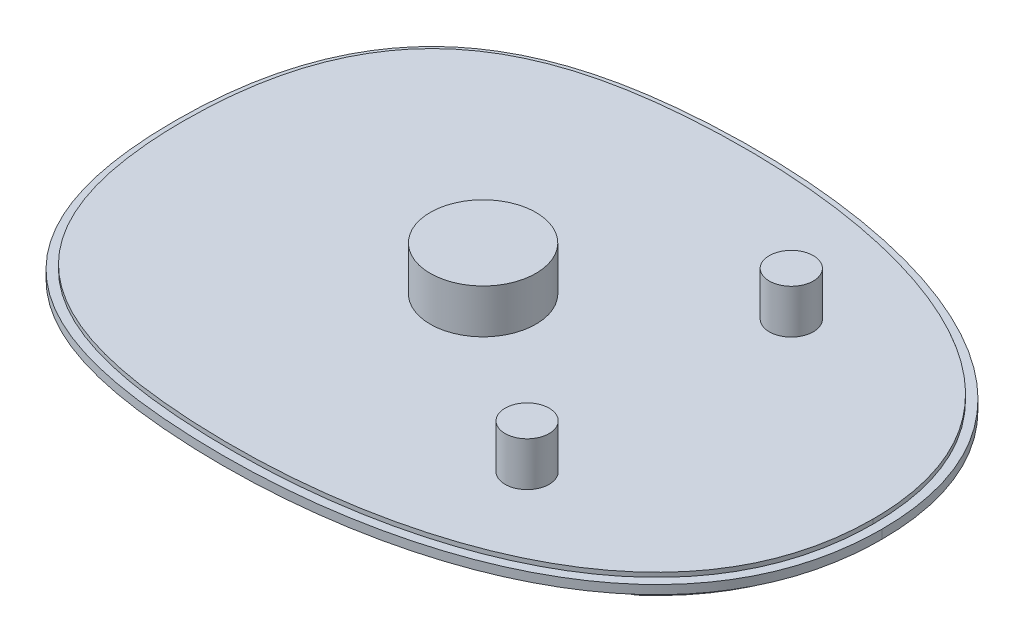
from build123d import *

# Parameters (mm, degrees)
BOSS_EXTRUDE1_DEPTH   = 1.5
BOSS_EXTRUDE1_2_DEPTH = 1.5
BOSS_EXTRUDE1_3_DEPTH = 1.5
FILLET1_R             = 3
FILLET2_R             = 3
FILLET3_R             = 3
FILLET4_R             = 3
FILLET5_R             = 1
FILLET6_R             = 1
THICKEN1_T1           = 1
BOSS_EXTRUDE2_DEPTH   = 0.5
SKETCH17_R            = 6
SKETCH17_R_2          = 2.5
BOSS_EXTRUDE3_DEPTH   = 5
CUT_EXTRUDE1_DEPTH    = 0.2


with BuildPart() as part:
    # Sketch15 → Boss-Extrude1 (new body)
    with BuildSketch(Plane(origin=(0, 0, 0), x_dir=(1, 0, 0), z_dir=(0, 1, 0))):
        with BuildLine():
            Line((19.985257037, -7.839704856), (28.712135723, -7.839704856))
            ThreePointArc((28.712135723, -7.839704856), (30.917651866, -16.701566284), (34.673373633, -25.025714494))
            add(Edge.make_bspline(
                [(19.985257037, -7.839704856), (20.003327882, -7.930211158), (20.19506768, -8.87054248), (20.822765862, -11.376552189), (22.196120959, -14.845666289), (24.350543071, -18.216816198), (26.968787622, -20.920168116), (30.034380428, -23.060139462), (32.704245401, -24.316847198), (34.310045449, -24.901265657), (34.673373633, -25.025714494)],
                knots=[0.059197915, 0.059197915, 0.059197915, 0.059197915, 0.061364536, 0.081819381, 0.122729072, 0.163638762, 0.204548453, 0.245458143, 0.286367834, 0.298081639, 0.298081639, 0.298081639, 0.298081639], degree=3))
        make_face()
    extrude(amount=-BOSS_EXTRUDE1_DEPTH)

    # Fillet1
    fillet1_edges = [part.edges().sort_by_distance(p)[0] for p in [
        (34.673373633, -0.75, 25.025714494),
    ]]
    fillet(fillet1_edges, radius=FILLET1_R)

    # Fillet5
    fillet5_edges = [part.edges().sort_by_distance(p)[0] for p in [
        (28.712135723, -0.75, 7.839704856),
        (19.985257037, -0.75, 7.839704856),
    ]]
    fillet(fillet5_edges, radius=FILLET5_R)



with BuildPart() as body_2:
    # Sketch15 → Boss-Extrude1 2 (new body)
    with BuildSketch(Plane(origin=(0, 0, 0), x_dir=(1, 0, 0), z_dir=(0, 1, 0))):
        with BuildLine():
            Line((19.829867125, 7.839704856), (28.726233836, 7.839704856))
            ThreePointArc((28.726233836, 7.839704856), (31.127428694, 17.204163616), (35.258274132, 25.944583548))
            add(Edge.make_bspline(
                [(35.258274132, 25.944583548), (34.667512014, 25.754792743), (32.849163506, 25.111219527), (30.008079189, 23.768252633), (26.974920854, 21.65550934), (24.380595333, 18.997450924), (22.240896245, 15.694723246), (20.869798385, 12.305832928), (20.156117717, 9.547170615), (19.906876439, 8.276418024), (19.829867125, 7.839704856)],
                knots=[0.694472016, 0.694472016, 0.694472016, 0.694472016, 0.713148327, 0.753574179, 0.79400003, 0.834425881, 0.874851733, 0.915277584, 0.93549051, 0.945706924, 0.945706924, 0.945706924, 0.945706924], degree=3))
        make_face()
    extrude(amount=-BOSS_EXTRUDE1_2_DEPTH)

    # Fillet4
    fillet4_edges = [body_2.edges().sort_by_distance(p)[0] for p in [
        (35.258274132, -0.75, -25.944583548),
    ]]
    fillet(fillet4_edges, radius=FILLET4_R)

    # Fillet6
    fillet6_edges = [body_2.edges().sort_by_distance(p)[0] for p in [
        (28.726233836, -0.75, -7.839704856),
        (19.829867125, -0.75, -7.839704856),
    ]]
    fillet(fillet6_edges, radius=FILLET6_R)


with BuildPart() as body_3:
    # Sketch15 → Boss-Extrude1 3 (new body)
    with BuildSketch(Plane(origin=(0, 0, 0), x_dir=(1, 0, 0), z_dir=(0, 1, 0))):
        with BuildLine():
            ThreePointArc((77.380385855, -23.979122304), (85.811237438, 0), (77.380385855, 23.979122304))
            add(Edge.make_bspline(
                [(95.498366587, 0), (95.498366587, 0.421420358), (95.480029873, 1.273198105), (95.372179086, 2.902910453), (95.107917012, 4.854394326), (94.595758418, 7.05015953), (93.667041221, 9.799066074), (92.068914092, 12.917495162), (89.510281921, 16.206100443), (86.361572684, 19.072659912), (82.684034418, 21.530514445), (79.576000935, 23.075648772), (77.752531845, 23.830842642), (77.380385855, 23.979122304)],
                knots=[0, 0, 0, 0, 0.010892264, 0.021784527, 0.043569055, 0.065353582, 0.087138109, 0.130707164, 0.174276219, 0.217845274, 0.261414328, 0.304983383, 0.31599972, 0.31599972, 0.31599972, 0.31599972], degree=3))
            add(Edge.make_bspline(
                [(77.380385855, -23.979122304), (77.752531845, -23.830842642), (79.576000935, -23.075648772), (82.684034418, -21.530514445), (86.361572684, -19.072659912), (89.510281921, -16.206100443), (92.068914092, -12.917495162), (93.667041221, -9.799066074), (94.595758418, -7.05015953), (95.107917012, -4.854394326), (95.372179086, -2.902910453), (95.480029873, -1.273198105), (95.498366587, -0.421420358), (95.498366587, 0)],
                knots=[0.68400028, 0.68400028, 0.68400028, 0.68400028, 0.695016617, 0.738585672, 0.782154726, 0.825723781, 0.869292836, 0.912861891, 0.934646418, 0.956430945, 0.978215473, 0.989107736, 1, 1, 1, 1], degree=3))
        make_face()
    extrude(amount=-BOSS_EXTRUDE1_3_DEPTH)

    # Fillet2
    fillet2_edges = [body_3.edges().sort_by_distance(p)[0] for p in [
        (77.380385855, -0.75, 23.979122304),
    ]]
    fillet(fillet2_edges, radius=FILLET2_R)

    # Fillet3
    fillet3_edges = [body_3.edges().sort_by_distance(p)[0] for p in [
        (77.380385855, -0.75, -23.979122304),
    ]]
    fillet(fillet3_edges, radius=FILLET3_R)


with BuildPart() as part_1:
    add(part.part)

    add(body_2.part)  # Thicken1 merges body 2

    add(body_3.part)  # Thicken1 merges body 3
    # Sketch6 → Surface-Fill3: a flat surface bounded by the sketch
    with BuildSketch(Plane(origin=(0, 0, 0), x_dir=(1, 0, 0), z_dir=(0, 1, 0)), mode=Mode.PRIVATE) as surface_fill3_1_region:
        with BuildLine():
            add(Edge.make_bspline(
                [(17.2, 0), (17.2, -23.333333333), (49.687338171, -36.667533587), (97.498366587, -24.295652903), (97.498366587, 0)],
                knots=[0, 0, 0, 0, 0.420096817, 1, 1, 1, 1], degree=3))
            add(Edge.make_bspline(
                [(17.2, 0), (17.2, 23.333333333), (49.687338171, 36.667533587), (97.498366587, 24.295652903), (97.498366587, 0)],
                knots=[0, 0, 0, 0, 0.420096817, 1, 1, 1, 1], degree=3))
        make_face()
    surface_fill3_1 = surface_fill3_1_region.sketch.faces()[0]
    add(Solid.thicken(surface_fill3_1, THICKEN1_T1))

    # Sketch16 → Boss-Extrude2 (add)
    with BuildSketch(Plane(origin=(0, 1, 0), x_dir=(1, 0, 0), z_dir=(0, 1, 0))):
        with BuildLine():
            add(Edge.make_bspline(
                [(18.2, 0), (18.2, -2.319951803), (18.334480918, -4.617329005), (18.827932577, -8.014423587), (19.041503894, -9.1385484), (19.590928847, -11.366271139), (19.926597118, -12.469900182), (20.547870155, -14.105574212), (20.775182689, -14.647972419), (21.265078447, -15.70546511), (21.528500631, -16.222968933), (22.377548466, -17.739709111), (23.02191076, -18.703201334), (24.120383261, -20.068154363), (24.510010841, -20.510932445), (25.318703906, -21.351822368), (25.73927951, -21.752080378), (27.047724476, -22.894742824), (27.982330349, -23.579012838), (29.469396963, -24.49949212), (29.981234063, -24.789580186), (31.016634496, -25.32876011), (31.541282711, -25.57873407), (33.133663267, -26.276606578), (34.219744543, -26.672701318), (36.430656907, -27.35549002), (37.555521968, -27.642088063), (39.836245226, -28.127782478), (40.983419803, -28.324956004), (43.276328762, -28.648122937), (44.424288274, -28.774491875), (46.722493271, -28.97374292), (47.872710153, -29.047294286), (51.326241924, -29.200536204), (53.632537121, -29.210493992), (57.098083649, -29.082616463), (58.25428999, -29.016027363), (60.568869844, -28.832142015), (61.72555, -28.714870915), (65.171687852, -28.285075939), (67.445525535, -27.894847676), (71.937678408, -26.870296833), (74.156167645, -26.236739422), (77.429977205, -25.049335171), (78.515414888, -24.611948082), (80.634220391, -23.656756483), (81.670406519, -23.13822515), (83.689595073, -22.007389018), (84.672634064, -21.39514869), (86.576140588, -20.060342087), (87.500431292, -19.333562472), (89.23238766, -17.785919257), (90.044685336, -16.962528658), (91.173879886, -15.645026809), (91.535379562, -15.19210213), (92.226814263, -14.257105733), (92.557779862, -13.773369907), (94.116731862, -11.296439965), (95.029709876, -9.177974705), (95.778623314, -6.369156714), (95.909084266, -5.79744551), (96.129370705, -4.648270593), (96.219216886, -4.071639324), (96.432017008, -2.336032244), (96.498366587, -1.171356657), (96.498366587, 0)],
                knots=[0, 0, 0, 0, 0.0625, 0.0625, 0.09375, 0.09375, 0.125, 0.125, 0.140625, 0.140625, 0.15625, 0.15625, 0.1875, 0.1875, 0.203125, 0.203125, 0.21875, 0.21875, 0.25, 0.25, 0.265625, 0.265625, 0.28125, 0.28125, 0.3125, 0.3125, 0.34375, 0.34375, 0.375, 0.375, 0.40625, 0.40625, 0.4375, 0.4375, 0.5, 0.5, 0.53125, 0.53125, 0.5625, 0.5625, 0.625, 0.625, 0.6875, 0.6875, 0.71875, 0.71875, 0.75, 0.75, 0.78125, 0.78125, 0.8125, 0.8125, 0.84375, 0.84375, 0.859375, 0.859375, 0.875, 0.875, 0.9375, 0.9375, 0.953125, 0.953125, 0.96875, 0.96875, 1, 1, 1, 1], degree=3))
            add(Edge.make_bspline(
                [(96.498366587, 0), (96.498366587, 2.341465081), (96.234921911, 4.641317325), (95.49130255, 7.450689054), (95.321457859, 8.009986807), (94.93823358, 9.118541645), (94.72702697, 9.661656603), (94.035471632, 11.257997126), (93.497217593, 12.27823554), (92.270096422, 14.232912004), (91.58021104, 15.16854787), (90.056800359, 16.950715362), (89.239616549, 17.778851526), (87.509291531, 19.326247637), (86.596106607, 20.045457981), (85.162618156, 21.05198496), (84.673657295, 21.375618952), (83.686089057, 21.993803244), (83.1862245, 22.289282382), (80.659183592, 23.70462218), (78.550093097, 24.641091804), (75.288700663, 25.826936587), (74.18503237, 26.185193734), (71.947985079, 26.8351911), (70.82243225, 27.124595967), (67.439462869, 27.896352959), (65.170195987, 28.284788257), (60.608746924, 28.854626812), (58.316524547, 29.035666912), (54.862565468, 29.166055797), (53.708623408, 29.185826545), (51.395555209, 29.178531642), (50.234853989, 29.151392712), (47.915911607, 29.049895995), (46.759219814, 28.976411782), (44.452196856, 28.777412542), (43.301952366, 28.651188501), (41.00996081, 28.32923033), (39.868203548, 28.133579605), (37.59576977, 27.651636123), (36.464837628, 27.364781325), (34.253315266, 26.684295288), (33.168748543, 26.290012833), (31.581608945, 25.597339452), (31.059201456, 25.349520779), (30.029287266, 24.815890941), (29.520321487, 24.529172924), (28.028584851, 23.611064336), (27.093051719, 22.929598956), (25.785539063, 21.794660396), (25.365657609, 21.397567358), (24.558915349, 20.564516278), (24.170785737, 20.126966018), (23.066185963, 18.765146125), (22.419117315, 17.80498783), (21.566843492, 16.295501858), (21.302489472, 15.780789239), (20.810860536, 14.729664586), (20.583038128, 14.191797073), (19.955634298, 12.557675243), (19.615286885, 11.451908376), (19.057256961, 9.214632746), (18.8397312, 8.083091088), (18.50440609, 5.799079644), (18.386655934, 4.645950795), (18.234286234, 2.324940498), (18.2, 1.163040827), (18.2, 0)],
                knots=[0, 0, 0, 0, 0.0625, 0.0625, 0.078125, 0.078125, 0.09375, 0.09375, 0.125, 0.125, 0.15625, 0.15625, 0.1875, 0.1875, 0.21875, 0.21875, 0.234375, 0.234375, 0.25, 0.25, 0.3125, 0.3125, 0.34375, 0.34375, 0.375, 0.375, 0.4375, 0.4375, 0.5, 0.5, 0.53125, 0.53125, 0.5625, 0.5625, 0.59375, 0.59375, 0.625, 0.625, 0.65625, 0.65625, 0.6875, 0.6875, 0.71875, 0.71875, 0.734375, 0.734375, 0.75, 0.75, 0.78125, 0.78125, 0.796875, 0.796875, 0.8125, 0.8125, 0.84375, 0.84375, 0.859375, 0.859375, 0.875, 0.875, 0.90625, 0.90625, 0.9375, 0.9375, 0.96875, 0.96875, 1, 1, 1, 1], degree=3))
        make_face()
    extrude(amount=BOSS_EXTRUDE2_DEPTH)

    # Sketch17 → Boss-Extrude3 (add)
    with BuildSketch(Plane(origin=(0, 1.5, 0), x_dir=(1, 0, 0), z_dir=(0, 1, 0))):
        with Locations(Location((52.2, 0, 0), (0, 0, 270))):
            Circle(SKETCH17_R)
        with Locations(Location((72.2, 15, 0), (0, 0, 90))):
            Circle(SKETCH17_R_2)
        with Locations(Location((72.2, -15, 0), (0, 0, 90))):
            Circle(SKETCH17_R_2)
    extrude(amount=BOSS_EXTRUDE3_DEPTH)

    # Sketch18 → Cut-Extrude1 (cut)
    # profile 1 of 6: a face of its own
    with BuildSketch(Plane.XZ):
        Polygon((47.804610155, 4.439727193), (47.804610155, 4.798701552), (49.644353744, 4.798701552), (49.644353744, 4.439727193), (48.881533232, 4.439727193), (48.881533232, 1.298701552), (48.567430667, 1.298701552), (48.567430667, 4.439727193), align=None)
    # profile 2 of 6: a face of its own
    with BuildSketch(Plane.XZ):
        with BuildLine():
            Line((50.003328103, 3.85639386), (50.317430667, 3.85639386))
            Line((50.317430667, 3.85639386), (50.317430667, 3.479891456))
            add(Edge.make_bspline(
                [(50.317430667, 3.479891456), (50.340619426, 3.514947284), (50.384967747, 3.581991284), (50.458680676, 3.670660584), (50.534184008, 3.744075631), (50.611839195, 3.80257915), (50.692217295, 3.846392269), (50.773554247, 3.878485304), (50.857129717, 3.897462619), (50.913291641, 3.899996278), (50.941429065, 3.901265655)],
                knots=[0, 0, 0, 0, 1.2804753, 2.448899062, 3.506932113, 4.484331642, 5.4025378, 6.288909075, 7.142734305, 8, 8, 8, 8], degree=3))
            add(Edge.make_bspline(
                [(50.941429065, 3.901265655), (50.963255391, 3.900075128), (51.008164477, 3.897625542), (51.076147066, 3.880414718), (51.146190518, 3.852936695), (51.191332906, 3.827096472), (51.214866565, 3.81362543)],
                knots=[0, 0, 0, 0, 0.901110191, 1.854092781, 2.881294221, 4, 4, 4, 4], degree=3))
            Line((51.214866565, 3.81362543), (51.042390603, 3.541590174))
            add(Edge.make_bspline(
                [(51.042390603, 3.541590174), (51.027281582, 3.54833044), (50.998601768, 3.561124755), (50.956647201, 3.576266765), (50.917965865, 3.585182681), (50.893322306, 3.586533399), (50.881833712, 3.58716309)],
                knots=[0, 0, 0, 0, 1.180555205, 2.24091978, 3.179933427, 4, 4, 4, 4], degree=3))
            add(Edge.make_bspline(
                [(50.881833712, 3.58716309), (50.856627979, 3.585483053), (50.805215589, 3.582056264), (50.729731089, 3.555117456), (50.656483884, 3.511592216), (50.598312222, 3.463321104), (50.553269969, 3.416773307), (50.521129743, 3.376124904), (50.491646996, 3.330546273), (50.463476776, 3.280816589), (50.437810482, 3.226086743), (50.413855812, 3.166903529), (50.392196949, 3.103198401), (50.379846705, 3.05881588), (50.373520411, 3.03608136)],
                knots=[0, 0, 0, 0, 1.125678352, 2.296057538, 3.5422874, 4.923748041, 5.663163013, 6.437101912, 7.23742474, 8.08941207, 8.991984279, 9.93940061, 10.944477711, 12, 12, 12, 12], degree=3))
            add(Edge.make_bspline(
                [(50.373520411, 3.03608136), (50.368788018, 3.015804186), (50.358306126, 2.970891788), (50.348114588, 2.895543263), (50.33804507, 2.806519604), (50.330948452, 2.703573011), (50.32437041, 2.586960567), (50.320660327, 2.456504622), (50.317557187, 2.31207127), (50.31747412, 2.211096917), (50.317430667, 2.158276873)],
                knots=[0, 0, 0, 0, 0.566838948, 1.255505196, 2.06880316, 3.007127437, 4.065329342, 5.249902469, 6.561414163, 8, 8, 8, 8], degree=3))
            Line((50.317430667, 2.158276873), (50.317430667, 1.298701552))
            Line((50.317430667, 1.298701552), (50.003328103, 1.298701552))
            Line((50.003328103, 1.298701552), (50.003328103, 3.85639386))
        make_face()
    # profile 3 of 6: a face of its own
    with BuildSketch(Plane.XZ):
        with BuildLine():
            Line((54.131533232, 3.85639386), (54.131533232, 1.298701552))
            Line((54.131533232, 1.298701552), (53.817430667, 1.298701552))
            Line((53.817430667, 1.298701552), (53.817430667, 1.741109405))
            add(Edge.make_bspline(
                [(53.817430667, 1.741109405), (53.782011877, 1.701069811), (53.712891662, 1.62293204), (53.597450544, 1.520849867), (53.475082366, 1.436471546), (53.346381045, 1.36832163), (53.211462801, 1.317129573), (53.070626714, 1.280743414), (52.923815333, 1.257349579), (52.823562978, 1.255013557), (52.772759193, 1.253829757)],
                knots=[0, 0, 0, 0, 1.074387032, 2.096679803, 3.090159297, 4.057316773, 5.018401886, 5.985159533, 6.978961417, 8, 8, 8, 8], degree=3))
            add(Edge.make_bspline(
                [(52.772759193, 1.253829757), (52.727591239, 1.255056129), (52.638518034, 1.25747459), (52.507488957, 1.276236893), (52.381396708, 1.306367515), (52.260122135, 1.348268405), (52.14444999, 1.403849226), (52.033389893, 1.470390474), (51.927517201, 1.549631304), (51.828445662, 1.640219333), (51.737213662, 1.73861432), (51.657152389, 1.843559867), (51.590399309, 1.954602171), (51.534579228, 2.070335325), (51.491582884, 2.191650244), (51.46160925, 2.318127412), (51.442868803, 2.449617286), (51.440451342, 2.539156809), (51.439225539, 2.584558924)],
                knots=[0, 0, 0, 0, 1.033919861, 2.038935746, 3.024066025, 3.998881131, 4.97069526, 5.957263378, 6.95902576, 7.993208707, 9.027059324, 10.027763471, 11.009749337, 11.988697705, 12.965288445, 13.950418724, 14.960734635, 16, 16, 16, 16], degree=3))
            add(Edge.make_bspline(
                [(51.439225539, 2.584558924), (51.440478511, 2.629022627), (51.442955567, 2.716924971), (51.461408787, 2.846203669), (51.492439796, 2.970721929), (51.535987644, 3.090078873), (51.591829599, 3.204418923), (51.659757686, 3.313822948), (51.73977681, 3.418592345), (51.832029217, 3.516263572), (51.931963987, 3.606484186), (52.038872718, 3.684893232), (52.150096, 3.752610081), (52.26735901, 3.806263557), (52.388926115, 3.849672661), (52.515879561, 3.87970563), (52.647691139, 3.897402951), (52.737181632, 3.899965715), (52.782574898, 3.901265655)],
                knots=[0, 0, 0, 0, 1.020392517, 2.01726096, 2.990465484, 3.961182959, 4.928053699, 5.906110375, 6.912531644, 7.948652711, 8.985773172, 9.998621852, 10.987621588, 11.969261332, 12.953316658, 13.946091881, 14.958173133, 16, 16, 16, 16], degree=3))
            add(Edge.make_bspline(
                [(52.782574898, 3.901265655), (52.834774757, 3.899827903), (52.937136217, 3.89700854), (53.086864226, 3.873545813), (53.228508704, 3.833907346), (53.363163056, 3.779989848), (53.490343743, 3.708341119), (53.608846727, 3.617961158), (53.71991221, 3.509419971), (53.784292502, 3.426049526), (53.817430667, 3.383136648)],
                knots=[0, 0, 0, 0, 1.038897134, 2.037228247, 3.008116434, 3.962042015, 4.918381754, 5.904844433, 6.921570401, 8, 8, 8, 8], degree=3))
            Line((53.817430667, 3.383136648), (53.817430667, 3.85639386))
            Line((53.817430667, 3.85639386), (54.131533232, 3.85639386))
        make_face()
        with BuildLine():
            add(Edge.make_bspline(
                [(52.786781629, 3.58716309), (52.740867291, 3.585529453), (52.650239691, 3.582304912), (52.517195689, 3.557131417), (52.389882275, 3.515246822), (52.268936201, 3.457964921), (52.156267984, 3.385936184), (52.055574313, 3.298814801), (51.966031612, 3.198977787), (51.890723348, 3.086875677), (51.829332851, 2.966697585), (51.786165819, 2.841073147), (51.757696571, 2.71226817), (51.754788051, 2.624905484), (51.753328103, 2.581053315)],
                knots=[0, 0, 0, 0, 1.031046209, 2.035121221, 3.029706178, 4.034933723, 5.034054252, 6.02443088, 7.017295772, 8.038157696, 9.050218397, 10.03989886, 11.016116709, 12, 12, 12, 12], degree=3))
            add(Edge.make_bspline(
                [(51.753328103, 2.581053315), (51.755192997, 2.537463208), (51.758915473, 2.450453852), (51.785666168, 2.321473275), (51.830546041, 2.195819233), (51.891788104, 2.074558239), (51.968474729, 1.961974139), (52.057363381, 1.860234017), (52.159313663, 1.772744428), (52.27224117, 1.699506855), (52.39284914, 1.640344334), (52.519683072, 1.599178694), (52.65035871, 1.572600914), (52.739211044, 1.569496437), (52.783977142, 1.567932321)],
                knots=[0, 0, 0, 0, 0.979072187, 1.954306742, 2.945804271, 3.96968567, 4.997920485, 5.998718438, 6.996577872, 8.005894225, 9.015743152, 10.005417472, 10.995077863, 12, 12, 12, 12], degree=3))
            add(Edge.make_bspline(
                [(52.783977142, 1.567932321), (52.829423645, 1.569592285), (52.919812231, 1.572893789), (53.053250939, 1.598175054), (53.182745902, 1.639943852), (53.30653313, 1.697842979), (53.421849261, 1.769600335), (53.525347139, 1.853607426), (53.612863107, 1.95131061), (53.687055717, 2.058687063), (53.745231134, 2.17639906), (53.787607193, 2.30173325), (53.812661098, 2.434693999), (53.815818828, 2.525557926), (53.817430667, 2.571938732)],
                knots=[0, 0, 0, 0, 1.01762866, 2.023962475, 3.030623092, 4.058876274, 5.077231937, 6.066672613, 7.034107872, 8.005628644, 8.981990164, 9.965428785, 10.961468474, 12, 12, 12, 12], degree=3))
            add(Edge.make_bspline(
                [(53.817430667, 2.571938732), (53.816471011, 2.607276562), (53.814582104, 2.676832595), (53.800151534, 2.778960113), (53.777196608, 2.876693839), (53.744850438, 2.970136528), (53.702359153, 3.058771543), (53.651111387, 3.143235304), (53.590205938, 3.223088515), (53.520623242, 3.297231586), (53.444458039, 3.364858048), (53.363863498, 3.425222289), (53.277884751, 3.474811062), (53.187967714, 3.515852333), (53.09395638, 3.548511483), (52.99508576, 3.570299177), (52.892406773, 3.585259498), (52.822360718, 3.586521879), (52.786781629, 3.58716309)],
                knots=[0, 0, 0, 0, 1.050140795, 2.067009409, 3.05949893, 4.030605086, 5.00011959, 5.97591094, 6.962425594, 7.979863591, 8.993523472, 9.986985069, 10.967611495, 11.937549037, 12.921786183, 13.919465291, 14.943216303, 16, 16, 16, 16], degree=3))
        make_face(mode=Mode.SUBTRACT)
    # profile 4 of 6: a face of its own
    with BuildSketch(Plane.XZ):
        with BuildLine():
            Line((54.849481949, 3.85639386), (55.163584514, 3.85639386))
            Line((55.163584514, 3.85639386), (55.163584514, 3.411882642))
            add(Edge.make_bspline(
                [(55.163584514, 3.411882642), (55.191868463, 3.450770244), (55.246063223, 3.525282617), (55.334928876, 3.623472901), (55.423704988, 3.706801055), (55.48763837, 3.750543927), (55.518352142, 3.771558123)],
                knots=[0, 0, 0, 0, 1.134379233, 2.173579362, 3.122582517, 4, 4, 4, 4], degree=3))
            add(Edge.make_bspline(
                [(55.518352142, 3.771558123), (55.560216804, 3.791563488), (55.643214704, 3.831224701), (55.774633929, 3.87145826), (55.909108598, 3.896183361), (55.999916812, 3.899564735), (56.045595732, 3.901265655)],
                knots=[0, 0, 0, 0, 1.014936303, 2.012140481, 3.000054389, 4, 4, 4, 4], degree=3))
            add(Edge.make_bspline(
                [(56.045595732, 3.901265655), (56.076488728, 3.900220364), (56.137624307, 3.89815179), (56.228208397, 3.884691754), (56.316067009, 3.861425581), (56.400681038, 3.829018257), (56.480401718, 3.78977157), (56.553490915, 3.743721863), (56.619115124, 3.692024787), (56.677241175, 3.632345854), (56.7295102, 3.563009256), (56.777589047, 3.482145007), (56.822014259, 3.387937346), (56.846635568, 3.319570805), (56.859598135, 3.283577353)],
                knots=[0, 0, 0, 0, 1.009824226, 1.998387844, 2.986035974, 3.974953746, 4.955485308, 5.885931332, 6.793869504, 7.679848016, 8.601185859, 9.625726857, 10.749998409, 12, 12, 12, 12], degree=3))
            add(Edge.make_bspline(
                [(56.859598135, 3.283577353), (56.873309387, 3.308301773), (56.900291204, 3.356955958), (56.945596841, 3.42581422), (56.993064637, 3.490221012), (57.04309913, 3.550227436), (57.095523717, 3.605537166), (57.150585118, 3.656333068), (57.207969899, 3.702833282), (57.287762139, 3.757156441), (57.391574746, 3.814857623), (57.522462861, 3.864886067), (57.658613033, 3.895802195), (57.751030731, 3.899432468), (57.797699097, 3.901265655)],
                knots=[0, 0, 0, 0, 0.86119277, 1.694706429, 2.50939023, 3.298075842, 4.073795165, 4.829715201, 5.57930267, 6.321991688, 7.768977793, 9.186738141, 10.579381044, 12, 12, 12, 12], degree=3))
            add(Edge.make_bspline(
                [(57.797699097, 3.901265655), (57.84058056, 3.899648434), (57.924503746, 3.896483376), (58.046681012, 3.871629902), (58.160622817, 3.828952255), (58.266099893, 3.770718618), (58.361259707, 3.697539435), (58.443976016, 3.610470598), (58.513746379, 3.510127975), (58.559325019, 3.415735986), (58.590240283, 3.332400653), (58.609301517, 3.261394362), (58.626141212, 3.183242809), (58.640122458, 3.097852547), (58.65034101, 3.004921939), (58.657911725, 2.904603063), (58.663035799, 2.796817951), (58.663397871, 2.722452451), (58.663584514, 2.684118219)],
                knots=[0, 0, 0, 0, 1.209669288, 2.367440248, 3.500751976, 4.631527125, 5.755587489, 6.87532382, 8.007944318, 9.190864318, 9.82315674, 10.514484317, 11.263564316, 12.079023757, 12.955305781, 13.901327259, 14.918167583, 16, 16, 16, 16], degree=3))
            Line((58.663584514, 2.684118219), (58.663584514, 1.298701552))
            Line((58.663584514, 1.298701552), (58.349481949, 1.298701552))
            Line((58.349481949, 1.298701552), (58.349481949, 2.685520462))
            add(Edge.make_bspline(
                [(58.349481949, 2.685520462), (58.349404066, 2.718241036), (58.349254387, 2.781125003), (58.346560756, 2.871377454), (58.341485442, 2.953645812), (58.335550803, 3.0278179), (58.327306993, 3.094066688), (58.316661062, 3.152259107), (58.305383382, 3.202852918), (58.286647391, 3.258938966), (58.256699499, 3.320809176), (58.211082019, 3.387532752), (58.153611913, 3.445613552), (58.087251756, 3.496031869), (58.011703312, 3.53702551), (57.928438588, 3.56630152), (57.837974537, 3.584424398), (57.775351748, 3.586230414), (57.743011597, 3.58716309)],
                knots=[0, 0, 0, 0, 1.253487763, 2.409012846, 3.458416907, 4.410876679, 5.259312806, 6.014470957, 6.676830364, 7.243083969, 8.276244668, 9.299465089, 10.325150304, 11.392391894, 12.482080715, 13.603491619, 14.762376348, 16, 16, 16, 16], degree=3))
            add(Edge.make_bspline(
                [(57.743011597, 3.58716309), (57.703341643, 3.585746933), (57.624938731, 3.582948068), (57.510493245, 3.554374195), (57.400522229, 3.511293944), (57.298307096, 3.448861487), (57.204279305, 3.374053123), (57.123379727, 3.285103527), (57.056547542, 3.1844736), (57.011293566, 3.091326898), (56.982704264, 3.007657454), (56.963827349, 2.934560082), (56.949143957, 2.851478514), (56.935373428, 2.758971024), (56.9263857, 2.656400843), (56.918217328, 2.544242442), (56.914396465, 2.422158483), (56.913862006, 2.337531794), (56.913584514, 2.293593379)],
                knots=[0, 0, 0, 0, 1.090531906, 2.155305635, 3.229839962, 4.33261226, 5.44038871, 6.529323825, 7.629011124, 8.757537029, 9.370236727, 10.061839251, 10.834451254, 11.692844982, 12.636905849, 13.66920014, 14.789842145, 16, 16, 16, 16], degree=3))
            Line((56.913584514, 2.293593379), (56.913584514, 1.298701552))
            Line((56.913584514, 1.298701552), (56.599481949, 1.298701552))
            Line((56.599481949, 1.298701552), (56.599481949, 2.599282482))
            add(Edge.make_bspline(
                [(56.599481949, 2.599282482), (56.599402518, 2.6359758), (56.599249701, 2.706570057), (56.596573384, 2.807803733), (56.591486762, 2.899884813), (56.585606214, 2.982706277), (56.577146035, 3.056117605), (56.567536273, 3.120512363), (56.556187663, 3.175729115), (56.537397778, 3.236292499), (56.50868331, 3.303013422), (56.462495048, 3.374154444), (56.404887467, 3.436422541), (56.337316592, 3.48958129), (56.261310909, 3.533522771), (56.177327509, 3.565182523), (56.086122596, 3.583606812), (56.02324489, 3.585955309), (55.990908232, 3.58716309)],
                knots=[0, 0, 0, 0, 1.320475261, 2.540461679, 3.643808994, 4.639130445, 5.527981419, 6.302341397, 6.981980563, 7.553956391, 8.582137848, 9.585246428, 10.591171744, 11.620968678, 12.668337649, 13.738356861, 14.836885341, 16, 16, 16, 16], degree=3))
            add(Edge.make_bspline(
                [(55.990908232, 3.58716309), (55.95289202, 3.58563263), (55.877127061, 3.582582478), (55.765825091, 3.555128204), (55.658339407, 3.512124129), (55.556384709, 3.45246431), (55.46271056, 3.378565232), (55.380702293, 3.291650336), (55.311759767, 3.192801302), (55.266027953, 3.100636786), (55.236529478, 3.019063511), (55.216934144, 2.949712563), (55.200094518, 2.872712315), (55.187580496, 2.787825204), (55.175500081, 2.69560411), (55.169669772, 2.59558962), (55.163998209, 2.487867532), (55.163725795, 2.413494987), (55.163584514, 2.374923507)],
                knots=[0, 0, 0, 0, 1.098833095, 2.189935336, 3.297829714, 4.440610912, 5.596351641, 6.740013378, 7.886572111, 9.072425424, 9.705826452, 10.395263256, 11.156850408, 11.985370555, 12.878090359, 13.847760091, 14.883794034, 16, 16, 16, 16], degree=3))
            Line((55.163584514, 2.374923507), (55.163584514, 1.298701552))
            Line((55.163584514, 1.298701552), (54.849481949, 1.298701552))
            Line((54.849481949, 1.298701552), (54.849481949, 3.85639386))
        make_face()
    # profile 5 of 6: a face of its own
    with BuildSketch(Plane.XZ):
        Polygon((60.817430667, 4.798701552), (61.131533232, 4.798701552), (61.131533232, 1.657675911), (62.477687078, 1.657675911), (62.477687078, 1.298701552), (60.817430667, 1.298701552), align=None)
    # profile 6 of 6: a face of its own
    with BuildSketch(Plane.XZ):
        with BuildLine():
            Line((65.070435475, 2.10639386), (65.349481949, 1.959859405))
            add(Edge.make_bspline(
                [(65.349481949, 1.959859405), (65.327245354, 1.920416073), (65.283981746, 1.843674971), (65.209580998, 1.73824311), (65.131588925, 1.643395394), (65.046484957, 1.56166574), (64.956815278, 1.490414355), (64.862082624, 1.42807653), (64.761793806, 1.37495801), (64.655944081, 1.330205482), (64.54364453, 1.295795988), (64.424623013, 1.271491767), (64.298651518, 1.256468498), (64.212305338, 1.254723358), (64.168091725, 1.253829757)],
                knots=[0, 0, 0, 0, 1.120438281, 2.179929193, 3.190490725, 4.156257408, 5.095198341, 6.022838206, 6.959905092, 7.901321166, 8.864066838, 9.862729781, 10.905609505, 12, 12, 12, 12], degree=3))
            add(Edge.make_bspline(
                [(64.168091725, 1.253829757), (64.118949748, 1.254976932), (64.023087986, 1.257214739), (63.883548239, 1.276507204), (63.75216882, 1.307979562), (63.628957117, 1.351945104), (63.514214864, 1.409372428), (63.40771401, 1.47933191), (63.308894484, 1.561464164), (63.220870275, 1.656480608), (63.141626392, 1.758162565), (63.071700572, 1.86411845), (63.013243141, 1.974081674), (62.965690531, 2.087352198), (62.927285666, 2.203216092), (62.900518962, 2.322727559), (62.885089214, 2.445563144), (62.882724768, 2.528660479), (62.881533232, 2.570536488)],
                knots=[0, 0, 0, 0, 1.145258523, 2.234067595, 3.276747158, 4.290159414, 5.277019952, 6.260822364, 7.254936242, 8.264827045, 9.274100331, 10.257902744, 11.220704747, 12.172965371, 13.118907548, 14.062713208, 15.023725156, 16, 16, 16, 16], degree=3))
            add(Edge.make_bspline(
                [(62.881533232, 2.570536488), (62.882592373, 2.609831318), (62.884691451, 2.687708483), (62.897922238, 2.802974028), (62.921370532, 2.91500248), (62.953546856, 3.023886928), (62.995098102, 3.129445062), (63.045930321, 3.231741126), (63.106122699, 3.330666266), (63.152595372, 3.393069399), (63.176004385, 3.424502834)],
                knots=[0, 0, 0, 0, 1.024358464, 2.0301432, 3.019427413, 4.004406732, 4.986367066, 5.972626655, 6.978780325, 8, 8, 8, 8], degree=3))
            add(Edge.make_bspline(
                [(63.176004385, 3.424502834), (63.207712068, 3.462371704), (63.270123015, 3.536909855), (63.37567937, 3.63484818), (63.489979566, 3.716891956), (63.611591193, 3.784899092), (63.741927667, 3.836572739), (63.879236958, 3.875080321), (64.025082544, 3.896658332), (64.124787765, 3.899706166), (64.175804065, 3.901265655)],
                knots=[0, 0, 0, 0, 1.030682036, 2.02871468, 2.997146059, 3.962720338, 4.930598197, 5.918074684, 6.934738563, 8, 8, 8, 8], degree=3))
            add(Edge.make_bspline(
                [(64.175804065, 3.901265655), (64.22825167, 3.899911606), (64.331141916, 3.89725527), (64.481174037, 3.872628937), (64.623134754, 3.833576382), (64.756967258, 3.778422592), (64.882685119, 3.70726304), (64.999471168, 3.619121199), (65.109322681, 3.516703111), (65.17323126, 3.437939902), (65.205751982, 3.397860206)],
                knots=[0, 0, 0, 0, 1.056321875, 2.072262726, 3.055038591, 4.01806755, 4.982017516, 5.957941055, 6.960871419, 8, 8, 8, 8], degree=3))
            add(Edge.make_bspline(
                [(65.205751982, 3.397860206), (65.22787892, 3.367656624), (65.271985513, 3.307450506), (65.327232613, 3.209279349), (65.375190008, 3.106568754), (65.413522969, 2.997658457), (65.44456247, 2.883838877), (65.467019289, 2.764296332), (65.480188907, 2.639066421), (65.482777605, 2.553739866), (65.484097334, 2.510240014)],
                knots=[0, 0, 0, 0, 0.94817472, 1.890038105, 2.849395472, 3.817997239, 4.812318967, 5.836947057, 6.897266129, 8, 8, 8, 8], degree=3))
            Line((65.484097334, 2.510240014), (63.195635796, 2.510240014))
            add(Edge.make_bspline(
                [(63.195635796, 2.510240014), (63.197175402, 2.476539549), (63.200202976, 2.410268946), (63.214318119, 2.313298162), (63.236566893, 2.22092482), (63.267835956, 2.133841778), (63.305702801, 2.050911651), (63.352088518, 1.972749614), (63.407428072, 1.899711684), (63.469153771, 1.831144546), (63.537860866, 1.770083785), (63.610143614, 1.715432009), (63.687037178, 1.669626412), (63.767935262, 1.632446522), (63.852707047, 1.603340206), (63.941379242, 1.583472386), (64.033777359, 1.570165279), (64.096763093, 1.568685614), (64.128828905, 1.567932321)],
                knots=[0, 0, 0, 0, 1.094153842, 2.151609401, 3.174256925, 4.172055639, 5.149267565, 6.128595816, 7.11444997, 8.118368179, 9.117203808, 10.09244225, 11.054858984, 12.015122123, 12.976791628, 13.957293641, 14.960065497, 16, 16, 16, 16], degree=3))
            add(Edge.make_bspline(
                [(64.128828905, 1.567932321), (64.160180052, 1.568540378), (64.222386743, 1.569746879), (64.3150276, 1.58147879), (64.406167128, 1.600449066), (64.495428111, 1.626339056), (64.580998957, 1.657915908), (64.660244507, 1.696018765), (64.733124723, 1.738168512), (64.801241689, 1.786378187), (64.867312683, 1.845386374), (64.932855169, 1.919022095), (65.003131822, 2.006109623), (65.047121415, 2.071655289), (65.070435475, 2.10639386)],
                knots=[0, 0, 0, 0, 0.99110716, 1.966546729, 2.947904876, 3.932708344, 4.903319531, 5.828989031, 6.710028674, 7.56322171, 8.463672341, 9.504779593, 10.677557249, 12, 12, 12, 12], degree=3))
        make_face()
        with BuildLine():
            add(Edge.make_bspline(
                [(65.16999477, 2.824342578), (65.158498145, 2.866005451), (65.136370844, 2.946193072), (65.090134479, 3.057233962), (65.038062939, 3.155921863), (64.976441207, 3.241501496), (64.906622482, 3.317505009), (64.825977299, 3.383923595), (64.735541406, 3.443341046), (64.635782265, 3.493493545), (64.53014048, 3.536183404), (64.419534288, 3.56480852), (64.3066765, 3.584418062), (64.230342214, 3.58624417), (64.191929866, 3.58716309)],
                knots=[0, 0, 0, 0, 1.154881502, 2.222775134, 3.210006277, 4.132804581, 5.035138423, 5.962687519, 6.919655026, 7.923214229, 8.944639381, 9.960483929, 10.97369054, 12, 12, 12, 12], degree=3))
            add(Edge.make_bspline(
                [(64.191929866, 3.58716309), (64.160580428, 3.586551419), (64.098609179, 3.585342273), (64.00730811, 3.573872144), (63.919628411, 3.554912299), (63.834923124, 3.528947342), (63.754302255, 3.49433874), (63.676107487, 3.453755513), (63.602327091, 3.404213929), (63.556185796, 3.366455074), (63.532875379, 3.347379437)],
                knots=[0, 0, 0, 0, 1.04873581, 2.073130211, 3.073294108, 4.04793562, 5.032784715, 6.005352987, 6.992311501, 8, 8, 8, 8], degree=3))
            add(Edge.make_bspline(
                [(63.532875379, 3.347379437), (63.516182097, 3.332285121), (63.482398963, 3.301737905), (63.437258441, 3.249108698), (63.394037969, 3.192357136), (63.354704316, 3.129312012), (63.318626729, 3.060691233), (63.284866752, 2.987073597), (63.25448034, 2.907900467), (63.23738423, 2.852728028), (63.22858852, 2.824342578)],
                knots=[0, 0, 0, 0, 0.879870761, 1.780643979, 2.707998968, 3.669668524, 4.684282772, 5.740141944, 6.837334558, 8, 8, 8, 8], degree=3))
            Line((63.22858852, 2.824342578), (65.16999477, 2.824342578))
        make_face(mode=Mode.SUBTRACT)
    extrude(amount=-CUT_EXTRUDE1_DEPTH, mode=Mode.SUBTRACT)


solid = part_1.part
